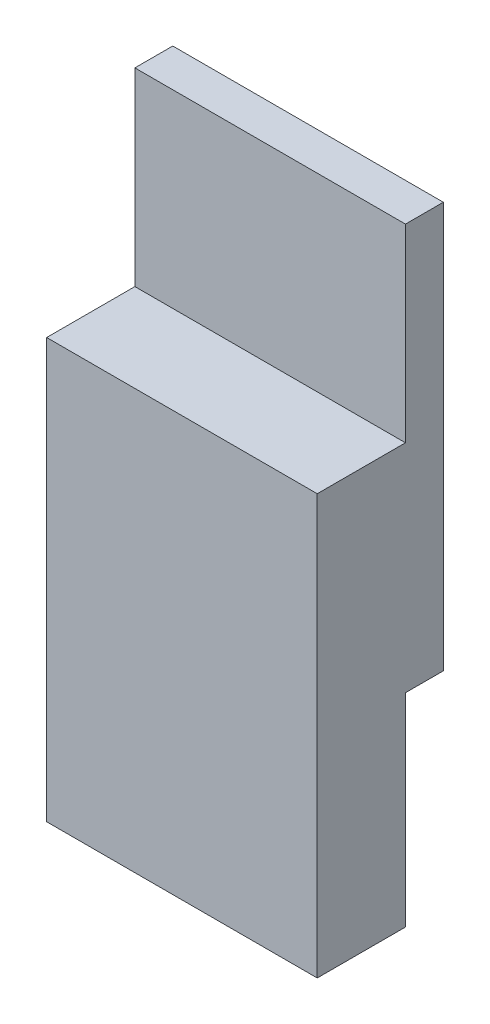
from build123d import *

# Parameters (mm, degrees)
SKETCH1_W           = 10
SKETCH1_H           = 15
BOSS_EXTRUDE1_DEPTH = 1.4
SKETCH2_W           = 10
SKETCH2_H           = 15.5
BOSS_EXTRUDE2_DEPTH = 3.26


with BuildPart() as part:
    # Sketch1 → Boss-Extrude1 (new body)
    with BuildSketch(Plane.XY):
        with Locations((-5, 0)):
            Rectangle(SKETCH1_W, SKETCH1_H)
    extrude(amount=BOSS_EXTRUDE1_DEPTH)

    # Sketch2 → Boss-Extrude2 (add)
    with BuildSketch(Plane.XY.offset(1.4)):
        with Locations((-5, -7.25)):
            Rectangle(SKETCH2_W, SKETCH2_H)
    extrude(amount=BOSS_EXTRUDE2_DEPTH)


solid = part.part
